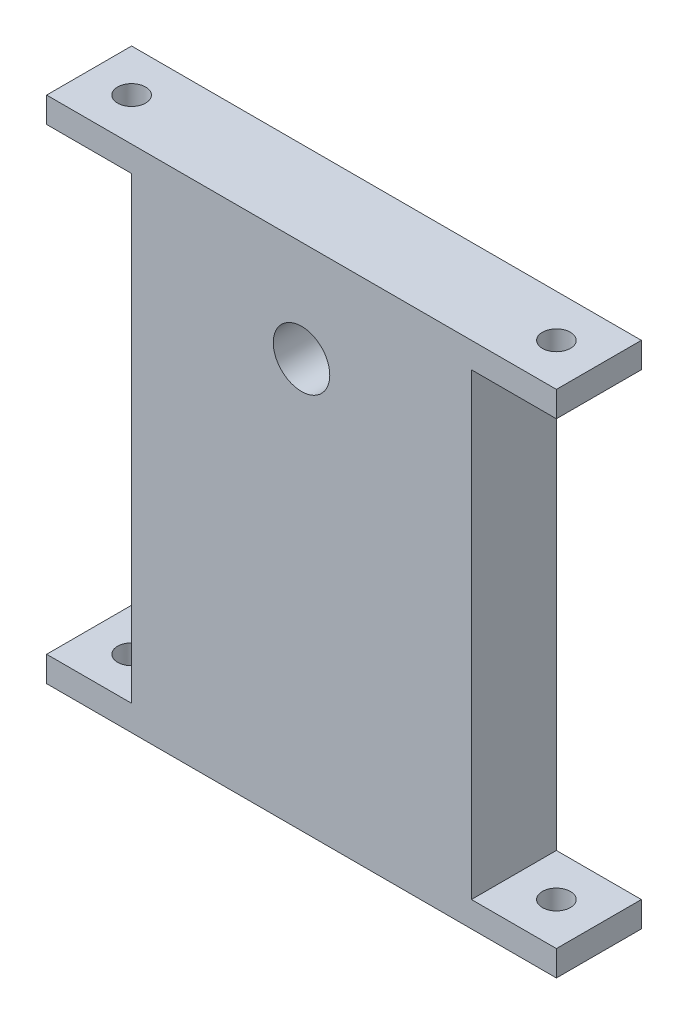
from build123d import *

# Parameters (mm, degrees)
SKETCH1_W                    = 40
SKETCH1_H                    = 60
SKETCH1_R                    = 3.325
BOSS_EXTRUDE1_DEPTH          = 10
ESQUISSE1_W                  = 10
ESQUISSE1_H                  = 3
BOSS_EXTRU_1_DEPTH           = 10
ESQUISSE2_W                  = 10
ESQUISSE2_H                  = 3
BOSS_EXTRU_2_DEPTH           = 10
ENL_V_MAT_EXTRU_1_DEPTH      = 66.184353951
ENL_V_MAT_EXTRU_1_DEPTH_BACK = 66.184353951
ESQUISSE3_R                  = 1.65


with BuildPart() as part:
    # Sketch1 → Boss-Extrude1 (new body)
    with BuildSketch(Plane.XY):
        Rectangle(SKETCH1_W, SKETCH1_H)
        with Locations((0, 18.11)):
            Circle(SKETCH1_R, mode=Mode.SUBTRACT)
    extrude(amount=BOSS_EXTRUDE1_DEPTH)

    # Esquisse1 → Boss.-Extru.1 (add)
    with BuildSketch(Plane(origin=(20, 0, 0), x_dir=(0, 0, -1), z_dir=(1, 0, 0))):
        with Locations((-5, 28.5)):
            Rectangle(ESQUISSE1_W, ESQUISSE1_H)
        with Locations((-5, -28.5)):
            Rectangle(ESQUISSE1_W, ESQUISSE1_H)
    extrude(amount=BOSS_EXTRU_1_DEPTH)

    # Esquisse2 → Boss.-Extru.2 (add)
    with BuildSketch(Plane.ZY.offset(20)):
        with Locations((5, 28.5)):
            Rectangle(ESQUISSE2_W, ESQUISSE2_H)
        with Locations((5, -28.5)):
            Rectangle(ESQUISSE2_W, ESQUISSE2_H)
    extrude(amount=BOSS_EXTRU_2_DEPTH)

    # Esquisse3 → Enlèv. mat.-Extru.1 (cut, two sides: drawn at the far end of the back side and taken through both)
    with BuildSketch(Plane.XZ.offset(-27).offset(-ENL_V_MAT_EXTRU_1_DEPTH_BACK)):
        with Locations((-25, 5)):
            Circle(ESQUISSE3_R)
        with Locations((25, 5)):
            Circle(ESQUISSE3_R)
    extrude(amount=ENL_V_MAT_EXTRU_1_DEPTH + ENL_V_MAT_EXTRU_1_DEPTH_BACK, mode=Mode.SUBTRACT)


solid = part.part
